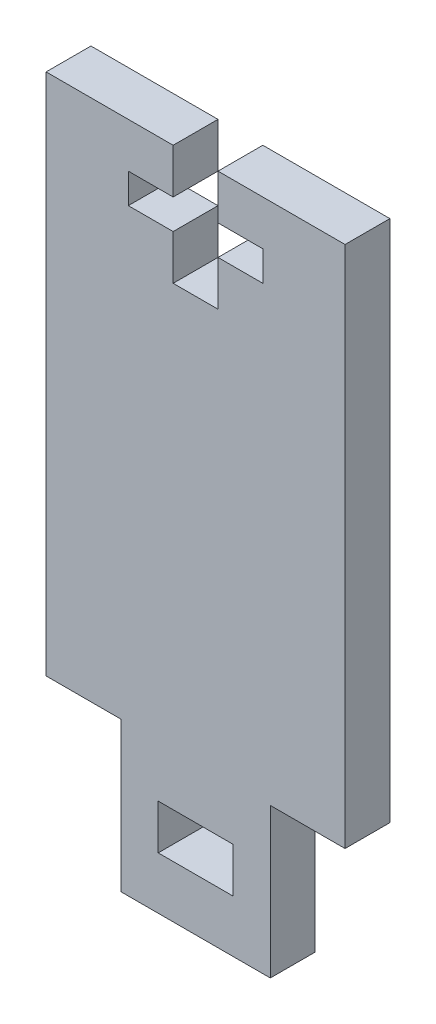
from build123d import *

# Parameters (mm, degrees)
SKETCH1_W           = 5
SKETCH1_H           = 3
BOSS_EXTRUDE1_DEPTH = 3


with BuildPart() as part:
    # Sketch1 → Boss-Extrude1 (new body)
    with BuildSketch(Plane.XY):
        Polygon((-1.5, 17.5), (-1.5, 14.5), (-4.5, 14.5), (-4.5, 12.5), (-1.5, 12.5), (-1.5, 9.5), (1.5, 9.5), (1.5, 12.5), (4.5, 12.5), (4.5, 14.5), (1.5, 14.5), (1.5, 17.5), (10, 17.5), (10, -17.5), (5, -17.5), (5, -27.5), (-5, -27.5), (-5, -17.5), (-10, -17.5), (-10, 17.5), align=None)
        with Locations((0, -22.5)):
            Rectangle(SKETCH1_W, SKETCH1_H, mode=Mode.SUBTRACT)
    extrude(amount=BOSS_EXTRUDE1_DEPTH)


solid = part.part
